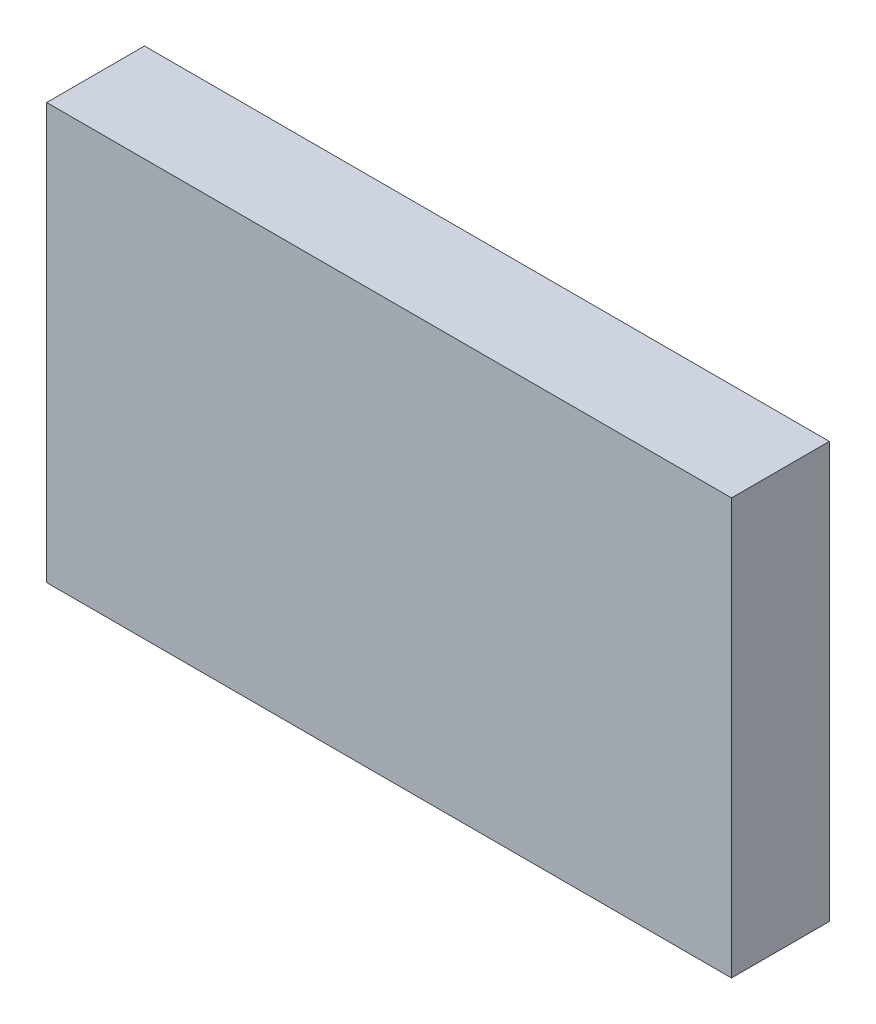
from build123d import *

# Parameters (mm, degrees)
SKETCH_1_W      = 140
SKETCH_1_H      = 85
EXTRUDE_1_DEPTH = 20


with BuildPart() as part:
    # 草图1 → 凸台-拉伸1 (new body)
    with BuildSketch(Plane.XY):
        with Locations((70, -42.5)):
            Rectangle(SKETCH_1_W, SKETCH_1_H)
    extrude(amount=EXTRUDE_1_DEPTH)


solid = part.part
